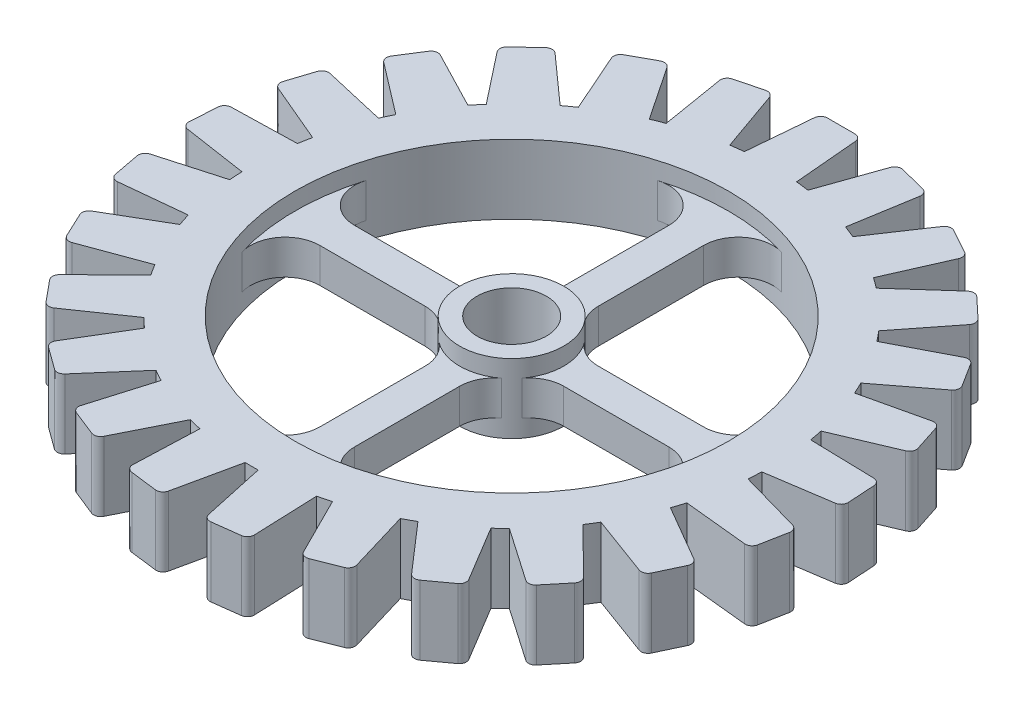
from build123d import *

# Parameters (mm, degrees)
BOSS_EXTRUDE1_DEPTH = 20
SKETCH2_R           = 10
CUT_EXTRUDE1_DEPTH  = 136.874477057
SKETCH4_R           = 62.5
SKETCH4_R_2         = 15
CUT_EXTRUDE2_DEPTH  = 5
CUT_EXTRUDE3_DEPTH  = 136.228966999


with BuildPart() as part:
    # Sketch1 → Boss-Extrude1 (new body)
    with BuildSketch(Plane(origin=(0, 0, 0), x_dir=(1, 0, 0), z_dir=(0, 1, 0))):
        with BuildLine():
            Line((-7.5, 75), (-5.909953778, 93.174311485))
            ThreePointArc((-5.909953778, 93.174311485), (-5.268744797, 94.474554674), (-3.917564381, 95))
            Line((-3.917564381, 95), (3.917564381, 95))
            ThreePointArc((3.917564381, 95), (5.268744797, 94.474554674), (5.909953778, 93.174311485))
            Line((5.909953778, 93.174311485), (7.5, 75))
            Line((7.5, 75), (7.533183111, 74.620715302))
            ThreePointArc((7.533183111, 74.620715302), (9.399992517, 74.408602599), (11.260902957, 74.149794771))
            Line((11.260902957, 74.149794771), (11.387367829, 74.508911238))
            Line((11.387367829, 74.508911238), (17.447227298, 91.716814893))
            ThreePointArc((17.447227298, 91.716814893), (18.391648851, 92.816746361), (19.831052388, 92.989658951))
            Line((19.831052388, 92.989658951), (27.420026173, 91.041141663))
            ThreePointArc((27.420026173, 91.041141663), (28.598083832, 90.196179263), (28.895790722, 88.777323416))
            Line((28.895790722, 88.777323416), (25.916115246, 70.778562931))
            Line((25.916115246, 70.778562931), (25.85393158, 70.402941855))
            ThreePointArc((25.85393158, 70.402941855), (27.609341451, 69.733236442), (29.347425078, 69.019769931))
            Line((29.347425078, 69.019769931), (29.559225457, 69.336153559))
            Line((29.559225457, 69.336153559), (39.708134916, 84.496413509))
            ThreePointArc((39.708134916, 84.496413509), (40.896427562, 85.326920518), (42.333611203, 85.136435638))
            Line((42.333611203, 85.136435638), (49.199586877, 81.36183357))
            ThreePointArc((49.199586877, 81.36183357), (50.130500084, 80.250446191), (50.065998864, 78.802129617))
            Line((50.065998864, 78.802129617), (42.703825658, 62.109848448))
            Line((42.703825658, 62.109848448), (42.550182443, 61.761492647))
            ThreePointArc((42.550182443, 61.761492647), (44.083893922, 60.676274578), (45.58994055, 59.552979108))
            Line((45.58994055, 59.552979108), (45.873768239, 59.806750351))
            Line((45.873768239, 59.806750351), (59.474034381, 71.966791709))
            ThreePointArc((59.474034381, 71.966791709), (60.831533323, 72.475690449), (62.176193533, 71.933776965))
            Line((62.176193533, 71.933776965), (67.887756593, 66.570262245))
            ThreePointArc((67.887756593, 66.570262245), (68.513032648, 65.262282444), (68.090376168, 63.8755082))
            Line((68.090376168, 63.8755082), (56.80829765, 49.538543762))
            Line((56.80829765, 49.538543762), (56.572848855, 49.239341714))
            ThreePointArc((56.572848855, 49.239341714), (57.788493208, 47.806799231), (58.967872388, 46.344255588))
            Line((58.967872388, 46.344255588), (59.30589345, 46.519469065))
            Line((59.30589345, 46.519469065), (75.502961535, 54.915231711))
            ThreePointArc((75.502961535, 54.915231711), (76.944370122, 55.070546202), (78.112016956, 54.21125453))
            Line((78.112016956, 54.21125453), (82.310288889, 47.595836516))
            ThreePointArc((82.310288889, 47.595836516), (82.590639398, 46.173449474), (81.836384718, 44.935353685))
            Line((81.836384718, 44.935353685), (67.343295375, 33.854550182))
            Line((67.343295375, 33.854550182), (67.040835113, 33.623301851))
            ThreePointArc((67.040835113, 33.623301851), (67.862028935, 31.933446867), (68.640635936, 30.223552047))
            Line((68.640635936, 30.223552047), (69.011611264, 30.30919845))
            Line((69.011611264, 30.30919845), (86.787759936, 34.413145739))
            ThreePointArc((86.787759936, 34.413145739), (88.222509165, 34.205117002), (89.139775078, 33.082439599))
            Line((89.139775078, 33.082439599), (91.560963018, 25.630789333))
            ThreePointArc((91.560963018, 25.630789333), (91.478772528, 24.183368859), (90.440312243, 23.171745637))
            Line((90.440312243, 23.171745637), (73.64686618, 16.043350706))
            Line((73.64686618, 16.043350706), (73.296399142, 15.894586274))
            ThreePointArc((73.296399142, 15.894586274), (73.671543805, 14.053598594), (74.000455885, 12.203791577))
            Line((74.000455885, 12.203791577), (74.381075736, 12.194489428))
            Line((74.381075736, 12.194489428), (92.619364197, 11.748755259))
            ThreePointArc((92.619364197, 11.748755259), (93.957303498, 11.190454503), (94.566553298, 9.874933318))
            Line((94.566553298, 9.874933318), (95.058525103, 2.055265392))
            ThreePointArc((95.058525103, 2.055265392), (94.618957944, 0.673758238), (93.361542334, -0.047828409))
            Line((93.361542334, -0.047828409), (75.322933529, -2.775911499))
            Line((75.322933529, -2.775911499), (74.946480847, -2.832844614))
            ThreePointArc((74.946480847, -2.832844614), (74.852004632, -4.709288965), (74.710555036, -6.582778001))
            Line((74.710555036, -6.582778001), (75.076903664, -6.686444213))
            Line((75.076903664, -6.686444213), (92.631353176, -11.653852724))
            ThreePointArc((92.631353176, -11.653852724), (93.7884149, -12.527345409), (94.051367183, -13.95305134))
            Line((94.051367183, -13.95305134), (92.583210455, -21.649398431))
            ThreePointArc((92.583210455, -21.649398431), (91.813886248, -22.878187091), (90.41652336, -23.26439722))
            Line((90.41652336, -23.26439722), (72.266183945, -21.420752974))
            Line((72.266183945, -21.420752974), (71.887399527, -21.382277456))
            ThreePointArc((71.887399527, -21.382277456), (71.329238722, -23.176274578), (70.726315248, -24.955727427))
            Line((70.726315248, -24.955727427), (71.055373622, -25.147243974))
            Line((71.055373622, -25.147243974), (86.82297356, -34.32420628))
            ThreePointArc((86.82297356, -34.32420628), (87.726455265, -35.458006135), (87.626587771, -36.904314467))
            Line((87.626587771, -36.904314467), (84.290552197, -43.993750931))
            ThreePointArc((84.290552197, -43.993750931), (83.239810411, -44.992611784), (81.790301694, -45.019178393))
            Line((81.790301694, -45.019178393), (64.668684248, -38.719649761))
            Line((64.668684248, -38.719649761), (64.311368511, -38.588183168))
            ThreePointArc((64.311368511, -38.588183168), (63.324594413, -40.187009623), (62.29808096, -41.760616718))
            Line((62.29808096, -41.760616718), (62.569173131, -42.02794991))
            Line((62.569173131, -42.02794991), (75.559187202, -54.837843719))
            ThreePointArc((75.559187202, -54.837843719), (76.152319811, -56.160709931), (75.695907582, -57.536743791))
            Line((75.695907582, -57.536743791), (70.701608546, -63.573814261))
            ThreePointArc((70.701608546, -63.573814261), (69.435471152, -64.279985208), (68.02489457, -63.945239019))
            Line((68.02489457, -63.945239019), (53.007813285, -53.585648552))
            Line((53.007813285, -53.585648552), (52.694417691, -53.369451413))
            ThreePointArc((52.694417691, -53.369451413), (51.341032945, -54.672647057), (49.955429129, -55.941532876))
            Line((49.955429129, -55.941532876), (50.15152138, -56.267885186))
            Line((50.15152138, -56.267885186), (59.547739226, -71.905817759))
            ThreePointArc((59.547739226, -71.905817759), (59.793254034, -73.334629777), (59.008975129, -74.553927897))
            Line((59.008975129, -74.553927897), (52.670222807, -79.159301034))
            ThreePointArc((52.670222807, -79.159301034), (51.268245875, -79.528410757), (49.985233142, -78.853385103))
            Line((49.985233142, -78.853385103), (38.016266464, -65.08466397))
            Line((38.016266464, -65.08466397), (37.766482811, -64.797320748))
            ThreePointArc((37.766482811, -64.797320748), (36.131525558, -65.723001003), (34.473893962, -66.607436785))
            Line((34.473893962, -66.607436785), (34.582665096, -66.972302296))
            Line((34.582665096, -66.972302296), (39.794687792, -84.455684817))
            ThreePointArc((39.794687792, -84.455684817), (39.677158201, -85.900665129), (38.614291749, -86.886614524))
            Line((38.614291749, -86.886614524), (31.329373261, -89.770917795))
            ThreePointArc((31.329373261, -89.770917795), (29.879648157, -89.779773772), (28.804815682, -88.806882999))
            Line((28.804815682, -88.806882999), (20.636017807, -72.494170587))
            Line((20.636017807, -72.494170587), (20.465540921, -72.153736111))
            ThreePointArc((20.465540921, -72.153736111), (18.651741537, -72.643737085), (16.826237252, -73.088150476))
            Line((16.826237252, -73.088150476), (16.840852777, -73.468603347))
            Line((16.840852777, -73.468603347), (17.54118977, -91.698890592))
            ThreePointArc((17.54118977, -91.698890592), (17.068000597, -93.06924577), (15.793330405, -93.759895613))
            Line((15.793330405, -93.759895613), (8.019983972, -94.741897636))
            ThreePointArc((8.019983972, -94.741897636), (6.613602257, -94.389943414), (5.814485717, -93.180317827))
            Line((5.814485717, -93.180317827), (1.959132257, -75.34860185))
            Line((1.959132257, -75.34860185), (1.878673827, -74.976466872))
            ThreePointArc((1.878673827, -74.976466872), (0, -75), (-1.878673827, -74.976466872))
            Line((-1.878673827, -74.976466872), (-1.959132257, -75.34860185))
            Line((-1.959132257, -75.34860185), (-5.814485717, -93.180317827))
            ThreePointArc((-5.814485717, -93.180317827), (-6.613602257, -94.389943414), (-8.019983972, -94.741897636))
            Line((-8.019983972, -94.741897636), (-15.793330405, -93.759895613))
            ThreePointArc((-15.793330405, -93.759895613), (-17.068000597, -93.06924577), (-17.54118977, -91.698890592))
            Line((-17.54118977, -91.698890592), (-16.840852777, -73.468603347))
            Line((-16.840852777, -73.468603347), (-16.826237252, -73.088150476))
            ThreePointArc((-16.826237252, -73.088150476), (-18.651741537, -72.643737085), (-20.465540921, -72.153736111))
            Line((-20.465540921, -72.153736111), (-20.636017807, -72.494170587))
            Line((-20.636017807, -72.494170587), (-28.804815682, -88.806882999))
            ThreePointArc((-28.804815682, -88.806882999), (-29.879648157, -89.779773772), (-31.329373261, -89.770917795))
            Line((-31.329373261, -89.770917795), (-38.614291749, -86.886614524))
            ThreePointArc((-38.614291749, -86.886614524), (-39.677158201, -85.900665129), (-39.794687792, -84.455684817))
            Line((-39.794687792, -84.455684817), (-34.582665096, -66.972302296))
            Line((-34.582665096, -66.972302296), (-34.473893962, -66.607436785))
            ThreePointArc((-34.473893962, -66.607436785), (-36.131525558, -65.723001003), (-37.766482811, -64.797320748))
            Line((-37.766482811, -64.797320748), (-38.016266464, -65.08466397))
            Line((-38.016266464, -65.08466397), (-49.985233142, -78.853385103))
            ThreePointArc((-49.985233142, -78.853385103), (-51.268245875, -79.528410757), (-52.670222807, -79.159301034))
            Line((-52.670222807, -79.159301034), (-59.008975129, -74.553927897))
            ThreePointArc((-59.008975129, -74.553927897), (-59.793254034, -73.334629777), (-59.547739226, -71.905817759))
            Line((-59.547739226, -71.905817759), (-50.15152138, -56.267885186))
            Line((-50.15152138, -56.267885186), (-49.955429129, -55.941532876))
            ThreePointArc((-49.955429129, -55.941532876), (-51.341032945, -54.672647057), (-52.694417691, -53.369451413))
            Line((-52.694417691, -53.369451413), (-53.007813285, -53.585648552))
            Line((-53.007813285, -53.585648552), (-68.02489457, -63.945239019))
            ThreePointArc((-68.02489457, -63.945239019), (-69.435471152, -64.279985208), (-70.701608546, -63.573814261))
            Line((-70.701608546, -63.573814261), (-75.695907582, -57.536743791))
            ThreePointArc((-75.695907582, -57.536743791), (-76.152319811, -56.160709931), (-75.559187202, -54.837843719))
            Line((-75.559187202, -54.837843719), (-62.569173131, -42.02794991))
            Line((-62.569173131, -42.02794991), (-62.29808096, -41.760616718))
            ThreePointArc((-62.29808096, -41.760616718), (-63.324594413, -40.187009623), (-64.311368511, -38.588183168))
            Line((-64.311368511, -38.588183168), (-64.668684248, -38.719649761))
            Line((-64.668684248, -38.719649761), (-81.790301694, -45.019178393))
            ThreePointArc((-81.790301694, -45.019178393), (-83.239810411, -44.992611784), (-84.290552197, -43.993750931))
            Line((-84.290552197, -43.993750931), (-87.626587771, -36.904314467))
            ThreePointArc((-87.626587771, -36.904314467), (-87.726455265, -35.458006135), (-86.82297356, -34.32420628))
            Line((-86.82297356, -34.32420628), (-71.055373622, -25.147243974))
            Line((-71.055373622, -25.147243974), (-70.726315248, -24.955727427))
            ThreePointArc((-70.726315248, -24.955727427), (-71.329238722, -23.176274578), (-71.887399527, -21.382277456))
            Line((-71.887399527, -21.382277456), (-72.266183945, -21.420752974))
            Line((-72.266183945, -21.420752974), (-90.41652336, -23.26439722))
            ThreePointArc((-90.41652336, -23.26439722), (-91.813886248, -22.878187091), (-92.583210455, -21.649398431))
            Line((-92.583210455, -21.649398431), (-94.051367183, -13.95305134))
            ThreePointArc((-94.051367183, -13.95305134), (-93.7884149, -12.527345409), (-92.631353176, -11.653852724))
            Line((-92.631353176, -11.653852724), (-75.076903664, -6.686444213))
            Line((-75.076903664, -6.686444213), (-74.710555036, -6.582778001))
            ThreePointArc((-74.710555036, -6.582778001), (-74.852004632, -4.709288965), (-74.946480847, -2.832844614))
            Line((-74.946480847, -2.832844614), (-75.322933529, -2.775911499))
            Line((-75.322933529, -2.775911499), (-93.361542334, -0.047828409))
            ThreePointArc((-93.361542334, -0.047828409), (-94.618957944, 0.673758238), (-95.058525103, 2.055265392))
            Line((-95.058525103, 2.055265392), (-94.566553298, 9.874933318))
            ThreePointArc((-94.566553298, 9.874933318), (-93.957303498, 11.190454503), (-92.619364197, 11.748755259))
            Line((-92.619364197, 11.748755259), (-74.381075736, 12.194489428))
            Line((-74.381075736, 12.194489428), (-74.000455885, 12.203791577))
            ThreePointArc((-74.000455885, 12.203791577), (-73.671543805, 14.053598594), (-73.296399142, 15.894586274))
            Line((-73.296399142, 15.894586274), (-73.64686618, 16.043350706))
            Line((-73.64686618, 16.043350706), (-90.440312243, 23.171745637))
            ThreePointArc((-90.440312243, 23.171745637), (-91.478772528, 24.183368859), (-91.560963018, 25.630789333))
            Line((-91.560963018, 25.630789333), (-89.139775078, 33.082439599))
            ThreePointArc((-89.139775078, 33.082439599), (-88.222509165, 34.205117002), (-86.787759936, 34.413145739))
            Line((-86.787759936, 34.413145739), (-69.011611264, 30.30919845))
            Line((-69.011611264, 30.30919845), (-68.640635936, 30.223552047))
            ThreePointArc((-68.640635936, 30.223552047), (-67.862028935, 31.933446867), (-67.040835113, 33.623301851))
            Line((-67.040835113, 33.623301851), (-67.343295375, 33.854550182))
            Line((-67.343295375, 33.854550182), (-81.836384718, 44.935353685))
            ThreePointArc((-81.836384718, 44.935353685), (-82.590639398, 46.173449474), (-82.310288889, 47.595836516))
            Line((-82.310288889, 47.595836516), (-78.112016956, 54.21125453))
            ThreePointArc((-78.112016956, 54.21125453), (-76.944370122, 55.070546202), (-75.502961535, 54.915231711))
            Line((-75.502961535, 54.915231711), (-59.30589345, 46.519469065))
            Line((-59.30589345, 46.519469065), (-58.967872388, 46.344255588))
            ThreePointArc((-58.967872388, 46.344255588), (-57.788493208, 47.806799231), (-56.572848855, 49.239341714))
            Line((-56.572848855, 49.239341714), (-56.80829765, 49.538543762))
            Line((-56.80829765, 49.538543762), (-68.090376168, 63.8755082))
            ThreePointArc((-68.090376168, 63.8755082), (-68.513032648, 65.262282444), (-67.887756593, 66.570262245))
            Line((-67.887756593, 66.570262245), (-62.176193533, 71.933776965))
            ThreePointArc((-62.176193533, 71.933776965), (-60.831533323, 72.475690449), (-59.474034381, 71.966791709))
            Line((-59.474034381, 71.966791709), (-45.873768239, 59.806750351))
            Line((-45.873768239, 59.806750351), (-45.58994055, 59.552979108))
            ThreePointArc((-45.58994055, 59.552979108), (-44.083893922, 60.676274578), (-42.550182443, 61.761492647))
            Line((-42.550182443, 61.761492647), (-42.703825658, 62.109848448))
            Line((-42.703825658, 62.109848448), (-50.065998864, 78.802129617))
            ThreePointArc((-50.065998864, 78.802129617), (-50.130500084, 80.250446191), (-49.199586877, 81.36183357))
            Line((-49.199586877, 81.36183357), (-42.333611203, 85.136435638))
            ThreePointArc((-42.333611203, 85.136435638), (-40.896427562, 85.326920518), (-39.708134916, 84.496413509))
            Line((-39.708134916, 84.496413509), (-29.559225457, 69.336153559))
            Line((-29.559225457, 69.336153559), (-29.347425078, 69.019769931))
            ThreePointArc((-29.347425078, 69.019769931), (-27.609341451, 69.733236442), (-25.85393158, 70.402941855))
            Line((-25.85393158, 70.402941855), (-25.916115246, 70.778562931))
            Line((-25.916115246, 70.778562931), (-28.895790722, 88.777323416))
            ThreePointArc((-28.895790722, 88.777323416), (-28.598083832, 90.196179263), (-27.420026173, 91.041141663))
            Line((-27.420026173, 91.041141663), (-19.831052388, 92.989658951))
            ThreePointArc((-19.831052388, 92.989658951), (-18.391648851, 92.816746361), (-17.447227298, 91.716814893))
            Line((-17.447227298, 91.716814893), (-11.387367829, 74.508911238))
            Line((-11.387367829, 74.508911238), (-11.260902957, 74.149794771))
            ThreePointArc((-11.260902957, 74.149794771), (-9.399992517, 74.408602599), (-7.533183111, 74.620715302))
            Line((-7.533183111, 74.620715302), (-7.5, 75))
        make_face()
    extrude(amount=BOSS_EXTRUDE1_DEPTH)

    # Sketch2 → Cut-Extrude1 (cut, through all)
    with BuildSketch(Plane.XZ):
        with Locations(Location((0, 0, 0), (0, 0, 270))):
            Circle(SKETCH2_R)
    extrude(amount=-CUT_EXTRUDE1_DEPTH, mode=Mode.SUBTRACT)

    # Sketch4 → Cut-Extrude2 (cut)
    with BuildSketch(Plane.XZ):
        with Locations(Location((0, 0, 0), (0, 0, 270))):
            Circle(SKETCH4_R)
        with Locations(Location((0, 0, 0), (0, 0, 270))):
            Circle(SKETCH4_R_2, mode=Mode.SUBTRACT)
    cut_extrude2 = extrude(amount=-CUT_EXTRUDE2_DEPTH, mode=Mode.SUBTRACT)

    # Mirror1: Cut-Extrude2 across plane
    add(cut_extrude2.mirror(Plane(origin=(0, 10, 0), x_dir=(0, 0, 1), z_dir=(0, -1, 0))), mode=Mode.SUBTRACT)

    # Sketch5 → Cut-Extrude3 (cut, through all)
    with BuildSketch(Plane.XZ.offset(-5)):
        with BuildLine():
            Line((-20, 5), (-50.311529494, 5))
            ThreePointArc((-50.311529494, 5), (-58.329366751, 9.023856953), (-59.894677969, 17.857142857))
            ThreePointArc((-59.894677969, 17.857142857), (-44.194173824, 44.194173824), (-17.857142857, 59.894677969))
            ThreePointArc((-17.857142857, 59.894677969), (-9.023856953, 58.329366751), (-5, 50.311529494))
            Line((-5, 50.311529494), (-5, 20))
            ThreePointArc((-5, 20), (-6.05572809, 15.527864045), (-9, 12))
            ThreePointArc((-9, 12), (-10.606601718, 10.606601718), (-12, 9))
            ThreePointArc((-12, 9), (-15.527864045, 6.05572809), (-20, 5))
        make_face()
        with BuildLine():
            Line((5, 20), (5, 50.311529494))
            ThreePointArc((5, 50.311529494), (9.023856953, 58.329366751), (17.857142857, 59.894677969))
            ThreePointArc((17.857142857, 59.894677969), (44.194173824, 44.194173824), (59.894677969, 17.857142857))
            ThreePointArc((59.894677969, 17.857142857), (58.329366751, 9.023856953), (50.311529494, 5))
            Line((50.311529494, 5), (20, 5))
            ThreePointArc((20, 5), (15.527864045, 6.05572809), (12, 9))
            ThreePointArc((12, 9), (10.606601718, 10.606601718), (9, 12))
            ThreePointArc((9, 12), (6.05572809, 15.527864045), (5, 20))
        make_face()
        with BuildLine():
            Line((20, -5), (50.311529494, -5))
            ThreePointArc((50.311529494, -5), (58.329366751, -9.023856953), (59.894677969, -17.857142857))
            ThreePointArc((59.894677969, -17.857142857), (44.194173824, -44.194173824), (17.857142857, -59.894677969))
            ThreePointArc((17.857142857, -59.894677969), (9.023856953, -58.329366751), (5, -50.311529494))
            Line((5, -50.311529494), (5, -20))
            ThreePointArc((5, -20), (6.05572809, -15.527864045), (9, -12))
            ThreePointArc((9, -12), (10.606601718, -10.606601718), (12, -9))
            ThreePointArc((12, -9), (15.527864045, -6.05572809), (20, -5))
        make_face()
        with BuildLine():
            Line((-5, -20), (-5, -50.311529494))
            ThreePointArc((-5, -50.311529494), (-9.023856953, -58.329366751), (-17.857142857, -59.894677969))
            ThreePointArc((-17.857142857, -59.894677969), (-44.194173824, -44.194173824), (-59.894677969, -17.857142857))
            ThreePointArc((-59.894677969, -17.857142857), (-58.329366751, -9.023856953), (-50.311529494, -5))
            Line((-50.311529494, -5), (-20, -5))
            ThreePointArc((-20, -5), (-15.527864045, -6.05572809), (-12, -9))
            ThreePointArc((-12, -9), (-10.606601718, -10.606601718), (-9, -12))
            ThreePointArc((-9, -12), (-6.05572809, -15.527864045), (-5, -20))
        make_face()
    extrude(amount=-CUT_EXTRUDE3_DEPTH, mode=Mode.SUBTRACT)


solid = part.part
